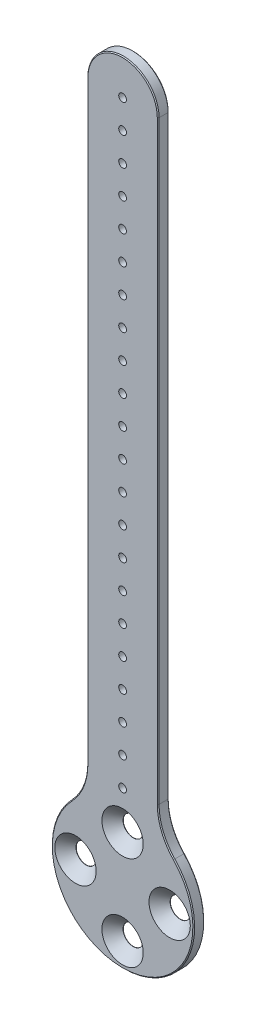
from build123d import *

# Parameters (mm, degrees)
BOSS_EXTRUDE1_DEPTH = 4.826
FILLET1_R           = 25.4
LPATTERN1_COUNT     = 22
LPATTERN1_PITCH     = 12.7
CIRPATTERN1_COUNT   = 4
CHAMFER1_SIZE       = 0.396875


with BuildPart() as part:
    # Sketch1 → Boss-Extrude1 (new body)
    with BuildSketch(Plane.XY):
        with BuildLine():
            Line((15.875, 27.49630657), (15.875, 304.8))
            ThreePointArc((15.875, 304.8), (0, 320.675), (-15.875, 304.8))
            Line((-15.875, 304.8), (-15.875, 27.49630657))
            ThreePointArc((-15.875, 27.49630657), (0, -31.75), (15.875, 27.49630657))
        make_face()
    extrude(amount=BOSS_EXTRUDE1_DEPTH)

    # Fillet1
    fillet1_edges = [part.edges().sort_by_distance(p)[0] for p in [
        (-15.875, 27.49630657, 2.413),
        (15.875, 27.49630657, 2.413),
    ]]
    fillet(fillet1_edges, radius=FILLET1_R)

    # Sketch3 → #8-32 Tapped Hole1 (revolve, cut)
    with BuildSketch(Plane(origin=(0, 304.8, 4.826), x_dir=(0, -1, 0), z_dir=(1, 0, 0))):
        Polygon((0, 0), (0, 11.705806461), (1.7272, 10.668), (1.7272, 0), align=None)
    f_8_32_tapped_hole1 = revolve(axis=Axis((0, 304.8, 11.176), (0, 0, -1)), mode=Mode.SUBTRACT)

    # LPattern1: #8-32 Tapped Hole1 ×22
    with Locations(*[(0, -i * LPATTERN1_PITCH, 0) for i in range(1, LPATTERN1_COUNT)]):
        add(f_8_32_tapped_hole1, mode=Mode.SUBTRACT)

    # Sketch7 → CSK for M8 SFHCS1 (revolve, cut)
    with BuildSketch(Plane(origin=(0, -20.9999961, 4.826), x_dir=(0, -1, 0), z_dir=(1, 0, 0))):
        Polygon((0, 0), (0, 28.103872786), (4.5, 25.4), (4.5, 4.714), (9.214, 0), align=None)
    csk_for_m8_sfhcs1 = revolve(axis=Axis((0, -20.9999961, 11.176), (0, 0, -1)), mode=Mode.SUBTRACT)

    # CirPattern1: CSK for M8 SFHCS1 ×4 about axis
    cirpattern1_axis = Axis((0, 0, 0), (0, 0, 1))
    for i in range(1, CIRPATTERN1_COUNT):
        add(csk_for_m8_sfhcs1.rotate(cirpattern1_axis, i * 360 / CIRPATTERN1_COUNT), mode=Mode.SUBTRACT)

    # Chamfer1
    chamfer1_edges = [part.edges().sort_by_distance(p)[0] for p in [
        (0, 320.675, 4.826),
        (-15.875, 172.164215612, 4.826),
        (0, -31.75, 0),
        (0, -31.75, 4.826),
        (15.875, 172.164215612, 0),
        (15.875, 172.164215612, 4.826),
        (-17.704797531, 30.062410119, 0),
        (-17.704797531, 30.062410119, 4.826),
        (17.704797531, 30.062410119, 0),
        (17.704797531, 30.062410119, 4.826),
        (-15.875, 172.164215612, 0),
        (0, 320.675, 0),
    ]]
    chamfer(chamfer1_edges, length=CHAMFER1_SIZE)


solid = part.part
